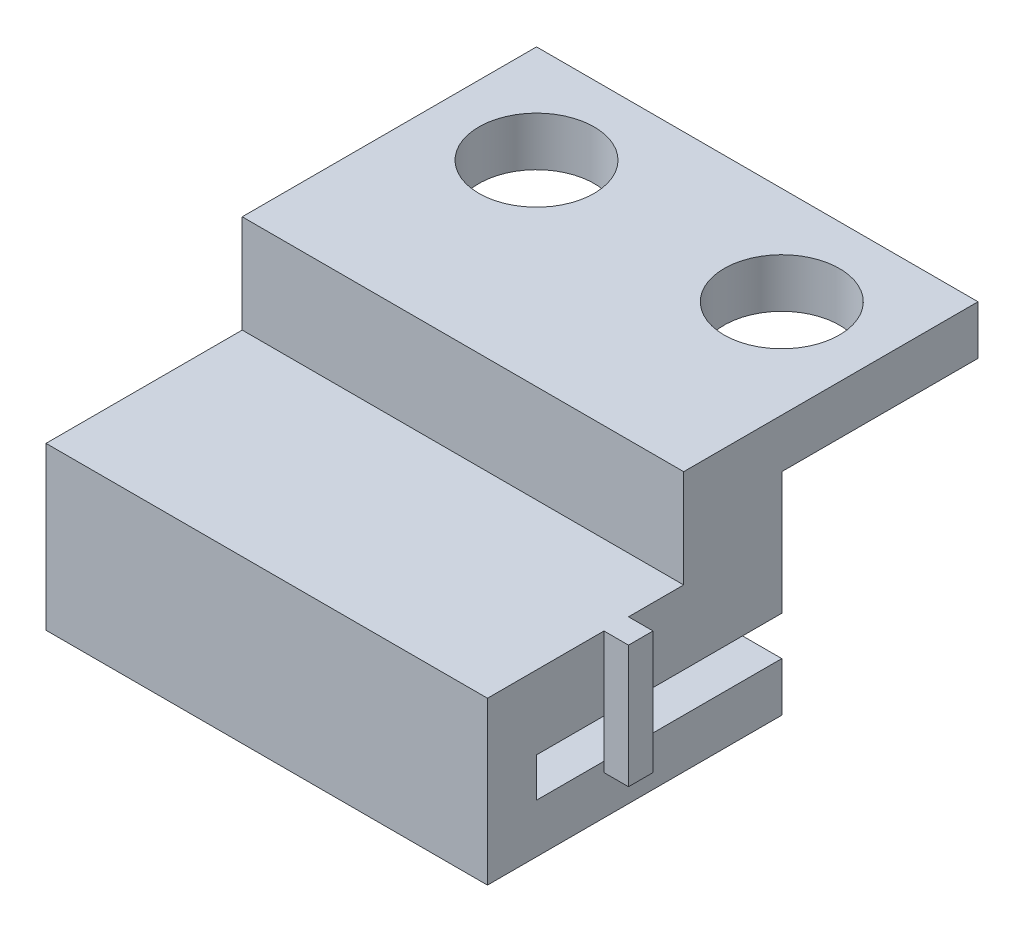
from build123d import *

# Parameters (mm, degrees)
SKETCH1_W           = 18
SKETCH1_H           = 12
SKETCH1_R           = 2.35
BOSS_EXTRUDE1_DEPTH = 2
BOSS_EXTRUDE2_DEPTH = 18
SKETCH3_W           = 1
SKETCH3_H           = 1
BOSS_EXTRUDE3_DEPTH = 5


with BuildPart() as part:
    # Sketch1 → Boss-Extrude1 (new body)
    with BuildSketch(Plane(origin=(0, 0, 0), x_dir=(1, 0, 0), z_dir=(0, 1, 0))):
        with Locations((0, -2)):
            Rectangle(SKETCH1_W, SKETCH1_H)
        with Locations(Location((-5, 0, 0), (0, 0, 270))):
            Circle(SKETCH1_R, mode=Mode.SUBTRACT)
        with Locations(Location((5, 0, 0), (0, 0, 270))):
            Circle(SKETCH1_R, mode=Mode.SUBTRACT)
    extrude(amount=BOSS_EXTRUDE1_DEPTH)

    # Sketch2 → Boss-Extrude2 (add)
    with BuildSketch(Plane(origin=(9, 0, 0), x_dir=(0, 0, -1), z_dir=(1, 0, 0))):
        Polygon((-4, 0), (-8, 0), (-8, -2), (-16, -2), (-16, -8.6), (-4, -8.6), (-4, -6.6), (-14, -6.6), (-14, -5), (-4, -5), align=None)
    extrude(amount=-BOSS_EXTRUDE2_DEPTH)

    # Sketch3 → Boss-Extrude3 (add)
    with BuildSketch(Plane(origin=(0, -2, 0), x_dir=(1, 0, 0), z_dir=(0, 1, 0))):
        with Locations((9.5, -10.75)):
            Rectangle(SKETCH3_W, SKETCH3_H)
    extrude(amount=-BOSS_EXTRUDE3_DEPTH)


solid = part.part
